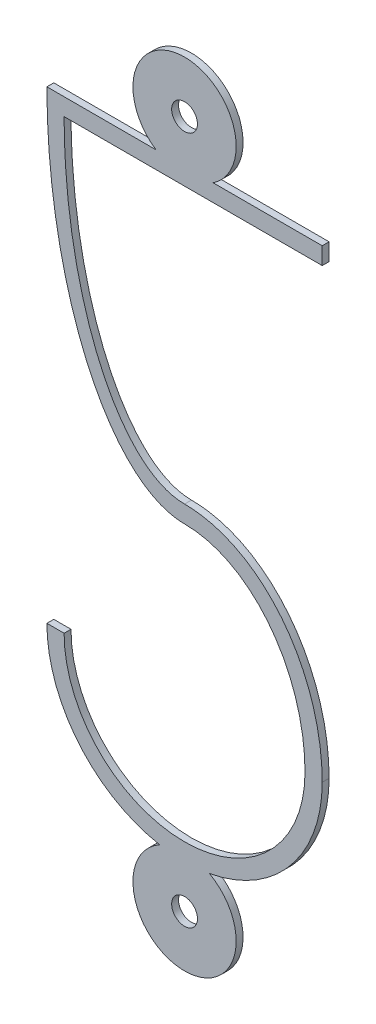
from build123d import *

# Parameters (mm, degrees)
SKETCH1_R           = 0.375
BOSS_EXTRUDE1_DEPTH = 0.1


with BuildPart() as part:
    # Sketch1 → Boss-Extrude1 (new, symmetric)
    with BuildSketch(Plane.XY):
        with BuildLine():
            Line((-4, -4.75), (-3.5, -4.75))
            ThreePointArc((-3.5, -4.75), (0, -8.25), (3.5, -4.75))
            add(Edge.make_bspline(
                [(3.5, -4.75), (3.5, -0.25), (0, -0.25)],
                knots=[4.71238898, 4.71238898, 4.71238898, 6.283185307, 6.283185307, 6.283185307], degree=2, weights=[1, 0.707106781, 1]))
            add(Edge.make_bspline(
                [(-4, 8.75), (-4, -0.25), (0, -0.25)],
                knots=[4.71238898, 4.71238898, 4.71238898, 6.283185307, 6.283185307, 6.283185307], degree=2, weights=[1, 0.707106781, 1]))
            Line((-4, 8.75), (-0.829156198, 8.75))
            ThreePointArc((-0.829156198, 8.75), (0, 11.5), (0.829156198, 8.75))
            Line((0.829156198, 8.75), (4, 8.75))
            Line((4, 8.75), (4, 8.25))
            Line((4, 8.25), (-3.5, 8.25))
            add(Edge.make_bspline(
                [(-3.5, 8.25), (-3.5, 0.25), (0, 0.25)],
                knots=[1.570796327, 1.570796327, 1.570796327, 3.141592654, 3.141592654, 3.141592654], degree=2, weights=[1, 0.707106781, 1]))
            add(Edge.make_bspline(
                [(4, -4.75), (4, 0.25), (0, 0.25)],
                knots=[4.71238898, 4.71238898, 4.71238898, 6.283185307, 6.283185307, 6.283185307], degree=2, weights=[1, 0.707106781, 1]))
            ThreePointArc((4, -4.75), (3.072711837, -7.310945522), (0.720779018, -8.68452381))
            ThreePointArc((0.720779018, -8.68452381), (0, -11.5), (-0.720779018, -8.68452381))
            ThreePointArc((-0.720779018, -8.68452381), (-3.072711837, -7.310945522), (-4, -4.75))
        make_face()
        with Locations((0, -10)):
            Circle(SKETCH1_R, mode=Mode.SUBTRACT)
        with Locations((0, 10)):
            Circle(SKETCH1_R, mode=Mode.SUBTRACT)
    extrude(amount=BOSS_EXTRUDE1_DEPTH, both=True)


solid = part.part
